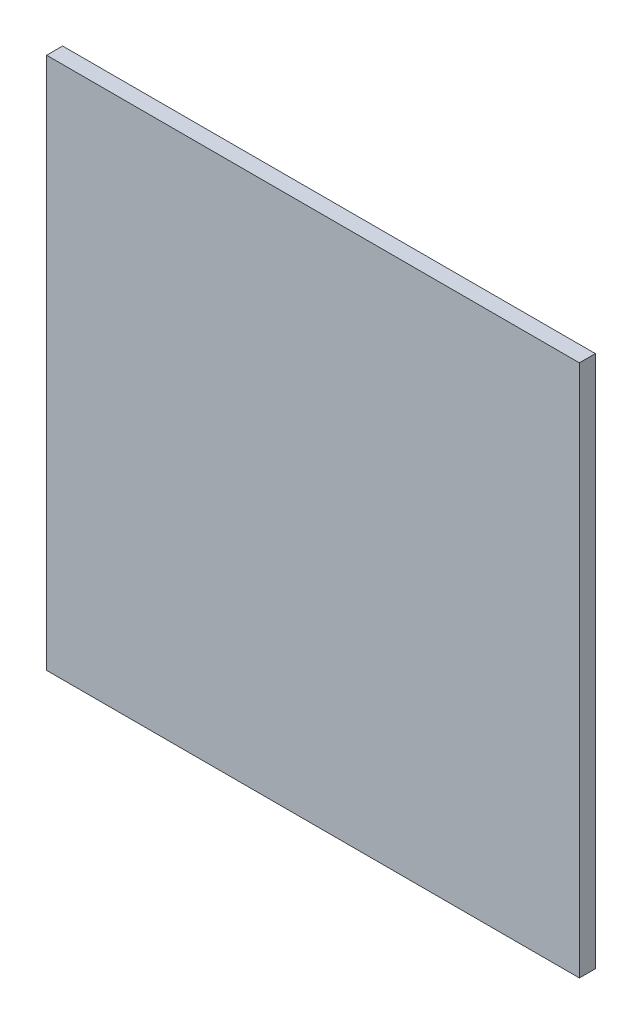
from build123d import *

# Parameters (mm, degrees)
SKETCH2_W           = 100
SKETCH2_H           = 100
BOSS_EXTRUDE1_DEPTH = 3


with BuildPart() as part:
    # Sketch2 → Boss-Extrude1 (new body)
    with BuildSketch(Plane(origin=(0, 0, 0), x_dir=(0, 1, 0), z_dir=(0, 0, 1))):
        Rectangle(SKETCH2_W, SKETCH2_H)
    extrude(amount=BOSS_EXTRUDE1_DEPTH)


solid = part.part
